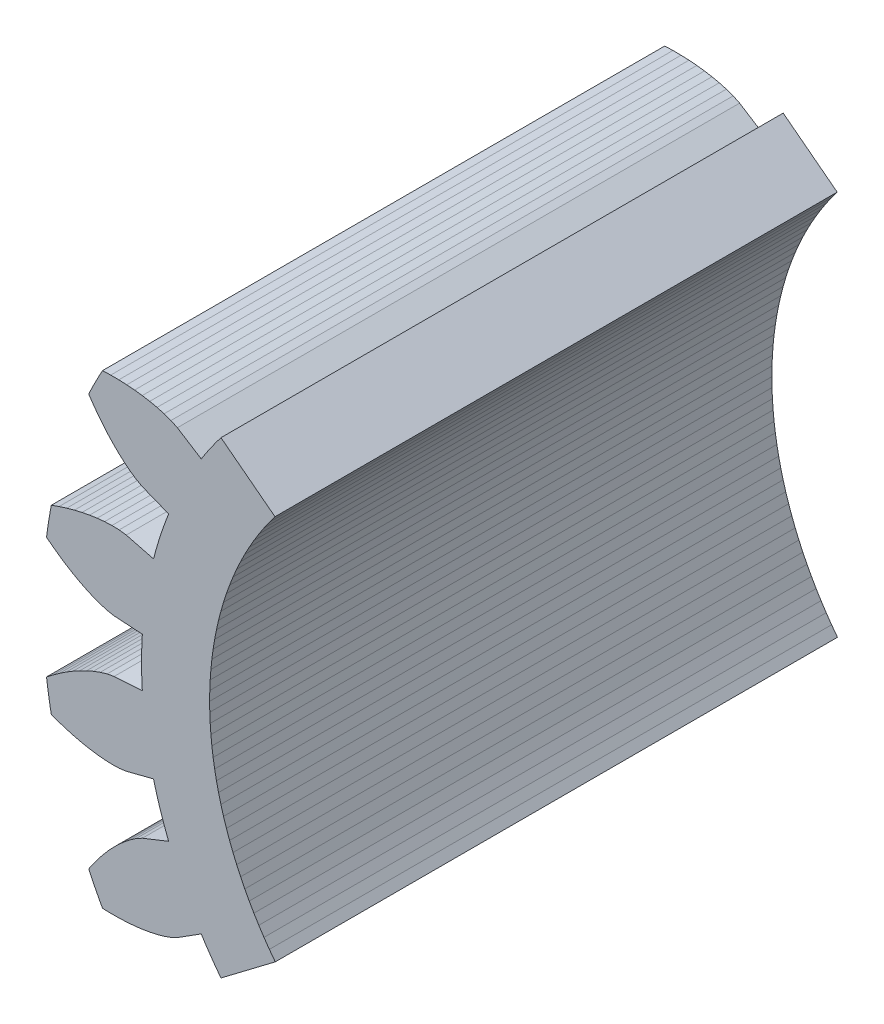
from build123d import *

# Parameters (mm, degrees)
SALIENTE_EXTRUIR1_DEPTH      = 16
SALIENTE_EXTRUIR1_DEPTH_BACK = 16


with BuildPart() as part:
    # Croquis1 → Saliente-Extruir1 (new, two sides: drawn at the far end of the back side and taken through both)
    with BuildSketch(Plane.XY.offset(-SALIENTE_EXTRUIR1_DEPTH_BACK)):
        Polygon((-17.354604319, 13.31665626), (-17.524034036, 13.092893343), (-17.690578836, 12.866974992), (-17.854211301, 12.638938397), (-18.014904493, 12.408821101), (-18.172631957, 12.176660986), (-18.327367727, 11.942496272), (-18.47908633, 11.706365508), (-18.81849812, 11.921380385), (-19.157909909, 12.136395262), (-19.497321699, 12.351410138), (-19.836733489, 12.566425015), (-20.201847825, 12.740776604), (-20.590135684, 12.877974642), (-20.993571444, 12.990096777), (-21.409381464, 13.080926686), (-21.835919748, 13.152464839), (-22.272026566, 13.205941226), (-22.716802236, 13.24217275), (-23.169503639, 13.26172687), (-23.629489326, 13.265008543), (-24.096187419, 13.25231119), (-24.261691948, 12.946826013), (-24.423323816, 12.639274258), (-24.581057223, 12.329705017), (-24.734866991, 12.018167704), (-24.884728569, 11.704712045), (-24.620682687, 11.31968204), (-24.347654955, 10.949474721), (-24.065744131, 10.594725216), (-23.774999633, 10.256190495), (-23.475399171, 9.9348053), (-23.166810677, 9.631777651), (-22.848920739, 9.348768759), (-22.521078436, 9.08828611), (-22.181853015, 8.854797617), (-21.826190794, 8.661895207), (-21.45273886, 8.513687875), (-21.079286927, 8.365480543), (-20.705834993, 8.21727321), (-20.332383059, 8.069065878), (-20.475722585, 7.698078308), (-20.612293661, 7.324546063), (-20.742051143, 6.948592618), (-20.864952138, 6.570342249), (-20.98095602, 6.189919989), (-21.090024443, 5.80745159), (-21.192121354, 5.423063482), (-21.581364399, 5.522670771), (-21.970607444, 5.622278059), (-22.359850489, 5.721885348), (-22.749093535, 5.821492636), (-23.150215507, 5.874484316), (-23.561895731, 5.884979858), (-23.980233585, 5.866945839), (-24.4037604, 5.824837853), (-24.831528919, 5.7610671), (-25.262816262, 5.677161749), (-25.697019218, 5.574176735), (-26.133606393, 5.452881382), (-26.572092871, 5.313859044), (-27.012025435, 5.157565501), (-27.075029485, 4.815888121), (-27.133711807, 4.473442026), (-27.188063035, 4.130281879), (-27.238074493, 3.786462455), (-27.283738198, 3.442038634), (-26.913634827, 3.157448003), (-26.53956967, 2.889730129), (-26.161832918, 2.639458536), (-25.780705486, 2.407337875), (-25.396455027, 2.194264026), (-25.009329236, 2.001426694), (-24.619543382, 1.830502636), (-24.227253259, 1.684077759), (-23.832478799, 1.566843426), (-23.434613803, 1.493288003), (-23.033641324, 1.467737448), (-22.632668844, 1.442186892), (-22.231696365, 1.416636337), (-21.830723885, 1.391085782), (-21.852406411, 0.993961287), (-21.866865412, 0.596508228), (-21.874096107, 0.198857987), (-21.874096107, -0.198857987), (-21.866865412, -0.596508228), (-21.852406411, -0.993961287), (-21.830723885, -1.391085782), (-22.231696365, -1.416636337), (-22.632668844, -1.442186892), (-23.033641324, -1.467737448), (-23.434613803, -1.493288003), (-23.832478799, -1.566843426), (-24.227253259, -1.684077759), (-24.619543382, -1.830502636), (-25.009329236, -2.001426694), (-25.396455027, -2.194264026), (-25.780705486, -2.407337875), (-26.161832918, -2.639458536), (-26.53956967, -2.889730129), (-26.913634827, -3.157448003), (-27.283738198, -3.442038634), (-27.238074493, -3.786462455), (-27.188063035, -4.130281879), (-27.133711807, -4.473442026), (-27.075029485, -4.815888121), (-27.012025435, -5.157565501), (-26.572092871, -5.313859044), (-26.133606393, -5.452881382), (-25.697019218, -5.574176735), (-25.262816262, -5.677161749), (-24.831528919, -5.7610671), (-24.4037604, -5.824837853), (-23.980233585, -5.866945839), (-23.561895731, -5.884979858), (-23.150215507, -5.874484316), (-22.749093535, -5.821492636), (-22.359850489, -5.721885348), (-21.970607444, -5.622278059), (-21.581364399, -5.522670771), (-21.192121354, -5.423063482), (-21.090024443, -5.80745159), (-20.98095602, -6.189919989), (-20.864952138, -6.570342249), (-20.742051143, -6.948592618), (-20.612293661, -7.324546063), (-20.475722585, -7.698078308), (-20.332383059, -8.069065878), (-20.705834993, -8.21727321), (-21.079286927, -8.365480543), (-21.45273886, -8.513687875), (-21.826190794, -8.661895207), (-22.181853015, -8.854797617), (-22.521078436, -9.08828611), (-22.848920739, -9.348768759), (-23.166810677, -9.631777651), (-23.475399171, -9.9348053), (-23.774999633, -10.256190495), (-24.065744131, -10.594725216), (-24.347654955, -10.949474721), (-24.620682687, -11.31968204), (-24.884728569, -11.704712045), (-24.734866991, -12.018167704), (-24.581057223, -12.329705017), (-24.423323816, -12.639274258), (-24.261691948, -12.946826013), (-24.096187419, -13.25231119), (-23.629489326, -13.265008543), (-23.169503639, -13.26172687), (-22.716802236, -13.24217275), (-22.272026566, -13.205941226), (-21.835919748, -13.152464839), (-21.409381464, -13.080926686), (-20.993571444, -12.990096777), (-20.590135684, -12.877974642), (-20.201847825, -12.740776604), (-19.836733489, -12.566425015), (-19.497321699, -12.351410138), (-19.157909909, -12.136395262), (-18.81849812, -11.921380385), (-18.47908633, -11.706365508), (-18.327367727, -11.942496272), (-18.172631957, -12.176660986), (-18.014904493, -12.408821101), (-17.854211301, -12.638938397), (-17.690578836, -12.866974992), (-17.524034036, -13.092893343), (-17.354604319, -13.31665626), (-14.265353493, -10.977524723), (-14.599984013, -10.52807992), (-14.906687017, -10.08913684), (-15.200197705, -9.641264944), (-15.480256324, -9.184860595), (-15.746615022, -8.720327708), (-15.999038076, -8.248077391), (-16.237302091, -7.768527583), (-16.461196206, -7.282102681), (-16.670522277, -6.789233169), (-16.86509505, -6.290355233), (-17.044742331, -5.785910375), (-17.209305133, -5.276345027), (-17.358637818, -4.762110151), (-17.49260823, -4.243660839), (-17.611097804, -3.721455917), (-17.714001678, -3.195957533), (-17.801228783, -2.667630748), (-17.872701924, -2.136943128), (-17.928357847, -1.604364328), (-17.968147298, -1.070365677), (-17.992035062, -0.53541976), (-18, 0), (-17.992035062, 0.53541976), (-17.968147298, 1.070365677), (-17.928357847, 1.604364328), (-17.872701924, 2.136943128), (-17.801228783, 2.667630748), (-17.714001678, 3.195957533), (-17.611097804, 3.721455917), (-17.49260823, 4.243660839), (-17.358637818, 4.762110151), (-17.209305133, 5.276345027), (-17.044742331, 5.785910375), (-16.86509505, 6.290355233), (-16.670522277, 6.789233169), (-16.461196206, 7.282102681), (-16.237302091, 7.768527583), (-15.999038076, 8.248077391), (-15.746615022, 8.720327708), (-15.480256324, 9.184860595), (-15.200197705, 9.641264944), (-14.906687017, 10.08913684), (-14.599984013, 10.52807992), (-14.280360125, 10.957705722), align=None)
    extrude(amount=SALIENTE_EXTRUIR1_DEPTH + SALIENTE_EXTRUIR1_DEPTH_BACK)


solid = part.part
